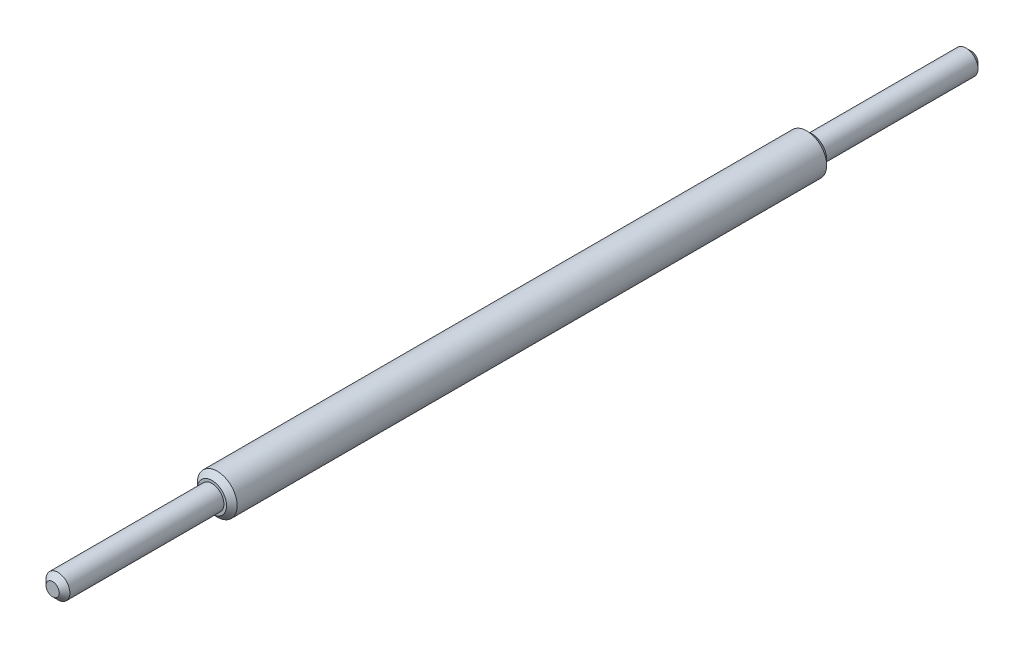
from build123d import *

# Parameters (mm, degrees)
SKETCH_1_R      = 4.5
EXTRUDE_1_DEPTH = 173
EXTRUDE_START   = -60
SKETCH_2_R      = 7.5
EXTRUDE_2_DEPTH = 226
CHAMFER_1_SIZE  = 2


with BuildPart() as part:
    # 草图1 → 凸台-拉伸1 (new, symmetric)
    with BuildSketch(Plane.XY):
        Circle(SKETCH_1_R)
    extrude(amount=EXTRUDE_1_DEPTH, both=True)

    # 草图2 → 凸台-拉伸2 (add)
    with BuildSketch(Plane.XY.offset(173).offset(EXTRUDE_START)):
        Circle(SKETCH_2_R)
    extrude(amount=-EXTRUDE_2_DEPTH)

    # 倒角1
    chamfer_1_edges = [part.edges().sort_by_distance(p)[0] for p in [
        (-4.5, 0, -173),
        (-4.5, 0, 173),
        (-7.5, 0, 113),
        (-7.5, 0, -113),
    ]]
    chamfer(chamfer_1_edges, length=CHAMFER_1_SIZE)


solid = part.part
